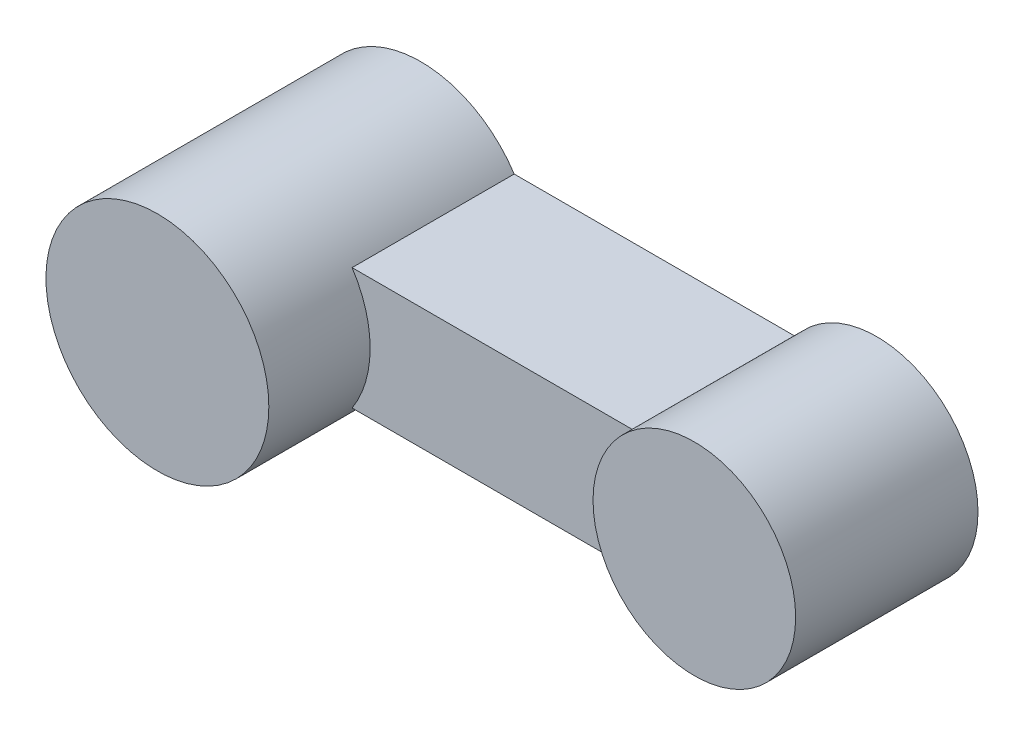
from build123d import *

# Parameters (mm, degrees)
SKETCH_3_W    = 45
SKETCH_3_H    = 12
BAR_DEPTH     = 16
SKETCH_4_R    = 11
ROOTHUB_DEPTH = 26
SKETCH_5_R    = 10
ENDHUB_DEPTH  = 18


with BuildPart() as part:
    # 草图3 → Bar (new body)
    with BuildSketch(Plane.XY):
        with Locations((42.5, 12)):
            Rectangle(SKETCH_3_W, SKETCH_3_H)
    extrude(amount=BAR_DEPTH)

    # 草图4 → RootHub (add)
    with BuildSketch(Plane.XY):
        with Locations(Location((20, 12, 0), (0, 0, 326.944268849))):
            Circle(SKETCH_4_R)
    extrude(amount=ROOTHUB_DEPTH)

    # 草图5 → EndHub (add)
    with BuildSketch(Plane.XY):
        with Locations(Location((65, 12, 0), (0, 0, 216.869897646))):
            Circle(SKETCH_5_R)
    extrude(amount=ENDHUB_DEPTH)


solid = part.part
